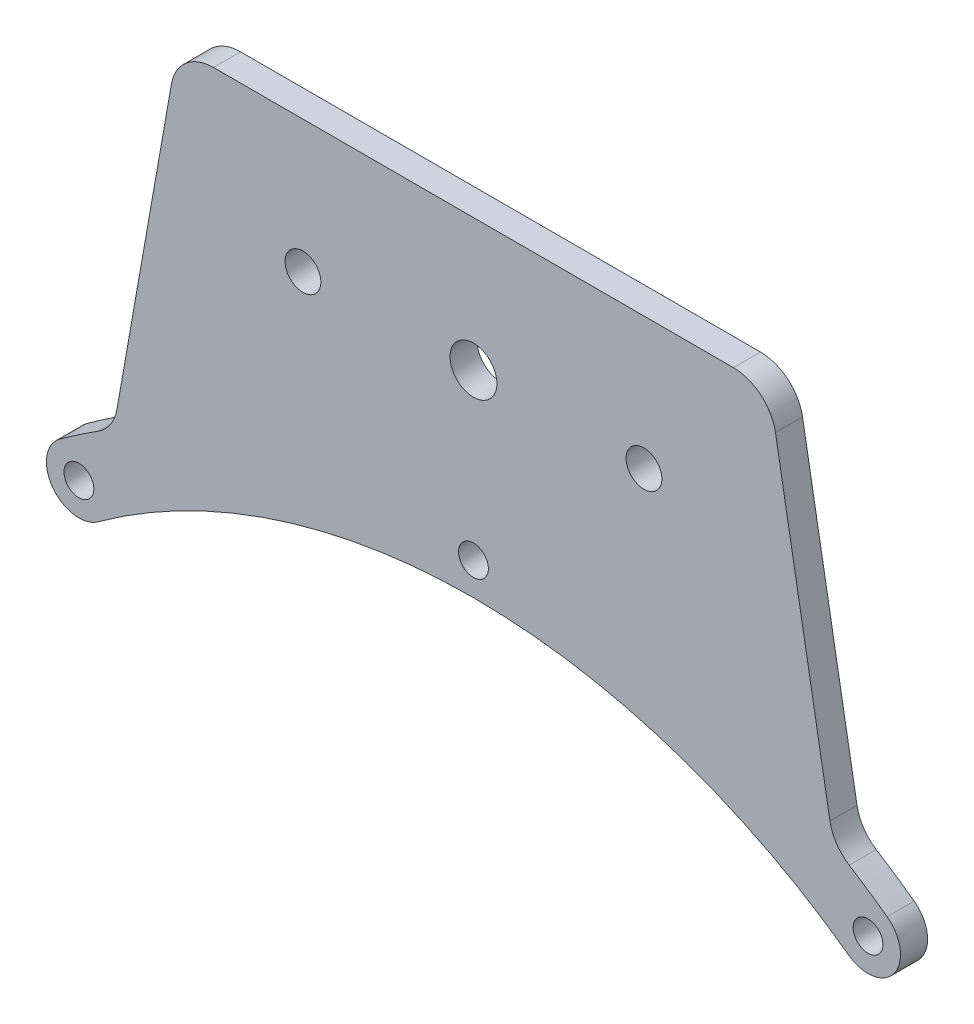
from build123d import *

# Parameters (mm, degrees)
SKETCH1_R           = 1.75
SKETCH1_R_2         = 2.1
SKETCH1_R_3         = 2.75
BOSS_EXTRUDE1_DEPTH = 1.5875


with BuildPart() as part:
    # Sketch1 → Boss-Extrude1 (new, symmetric)
    with BuildSketch(Plane.XY):
        with BuildLine():
            Line((-30.5, 34.81), (30.5, 34.81))
            ThreePointArc((30.5, 34.81), (33.713938048, 33.640222216), (35.424038765, 30.678240888))
            Line((35.424038765, 30.678240888), (41.817257659, -5.579505193))
            ThreePointArc((41.817257659, -5.579505193), (42.58957924, -7.49752424), (44.071890575, -8.939061889))
            ThreePointArc((44.071890575, -8.939061889), (46.321344226, -10.411121997), (48.521672577, -11.955647114))
            ThreePointArc((48.521672577, -11.955647114), (49.364565514, -17.277463674), (44.042748954, -18.120356611))
            ThreePointArc((44.042748954, -18.120356611), (0, -3.81), (-44.042748954, -18.120356611))
            ThreePointArc((-44.042748954, -18.120356611), (-49.364565514, -17.277463674), (-48.521672577, -11.955647114))
            ThreePointArc((-48.521672577, -11.955647114), (-46.321344226, -10.411121997), (-44.071890575, -8.939061889))
            ThreePointArc((-44.071890575, -8.939061889), (-42.58957924, -7.49752424), (-41.817257659, -5.579505193))
            Line((-41.817257659, -5.579505193), (-35.424038765, 30.678240888))
            ThreePointArc((-35.424038765, 30.678240888), (-33.713938048, 33.640222216), (-30.5, 34.81))
        make_face()
        Circle(SKETCH1_R, mode=Mode.SUBTRACT)
        with Locations((-46.282210766, -15.038001863)):
            Circle(SKETCH1_R, mode=Mode.SUBTRACT)
        with Locations((46.282210766, -15.038001863)):
            Circle(SKETCH1_R, mode=Mode.SUBTRACT)
        with Locations((-20, 19.31)):
            Circle(SKETCH1_R_2, mode=Mode.SUBTRACT)
        with Locations((20, 19.31)):
            Circle(SKETCH1_R_2, mode=Mode.SUBTRACT)
        with Locations((0, 19.31)):
            Circle(SKETCH1_R_3, mode=Mode.SUBTRACT)
    extrude(amount=BOSS_EXTRUDE1_DEPTH, both=True)


solid = part.part
